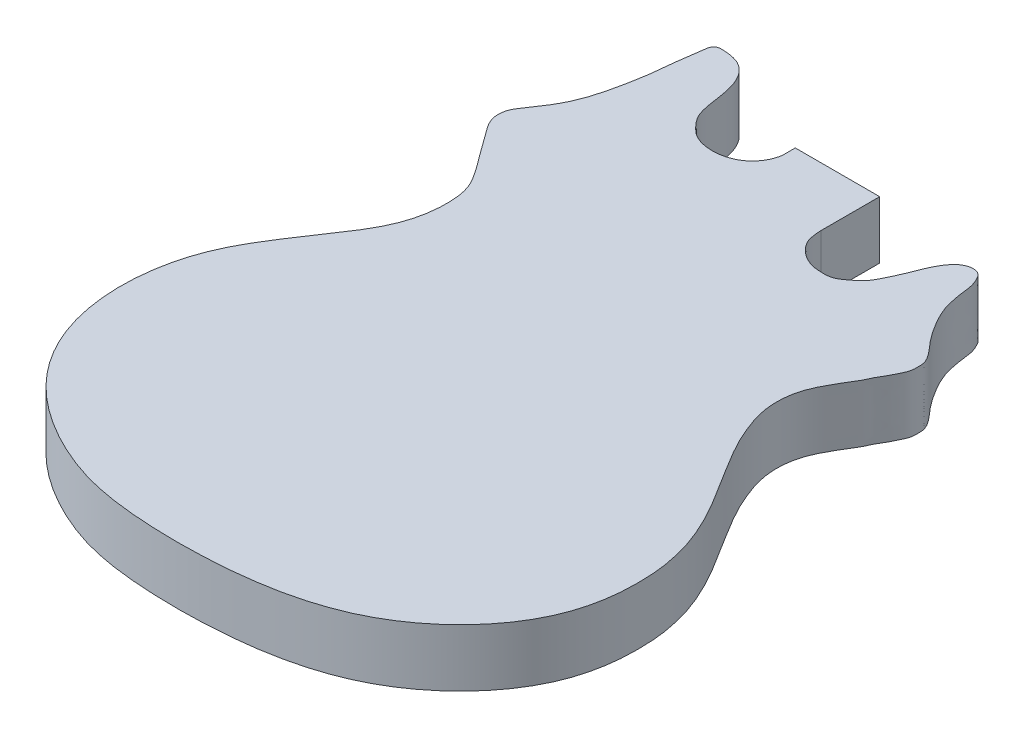
from build123d import *

# Parameters (mm, degrees)
BOSS_EXTRUDE1_DEPTH = 38.1


with BuildPart() as part:
    # Sketch1 → Boss-Extrude1 (new body)
    with BuildSketch(Plane(origin=(0, 0, 0), x_dir=(1, 0, 0), z_dir=(0, 1, 0))):
        with BuildLine():
            Line((366.883991573, 629.016482731), (366.883991573, 590.196800389))
            add(Edge.make_bspline(
                [(366.883991573, 590.196800389), (366.883991573, 588.721907352), (367.19538884, 585.916083136), (367.858429296, 580.868730205), (370.218301131, 576.638003721), (373.655967207, 572.913912014), (377.743592342, 569.646373817), (383.573889567, 566.898596584), (390.451252725, 566.258156737), (398.152644545, 566.261530517), (404.588586625, 571.033731223), (410.949677824, 576.083704953), (415.321825984, 584.401338354), (420.868571166, 596.52275749), (424.957746784, 609.035617041), (432.264639136, 616.878386573), (437.693112663, 619.09371419), (443.851152806, 618.35194404), (446.515597074, 613.311370609), (448.642354149, 608.203682212), (449.063572552, 602.574784341), (450.111658882, 596.350402716), (451.680776415, 587.862190501), (455.511908319, 579.431931165), (460.760977292, 570.728089525), (465.715796968, 563.472999064), (471.225219476, 557.625409545), (474.960319598, 552.644338219), (477.041501222, 548.646797619), (477.232146779, 544.285595262), (477.179636977, 538.900735945), (474.785544224, 534.530358586), (471.971226614, 528.396725227), (468.616650654, 523.796068396), (466.5381363, 518.275183369), (463.8413431, 514.164090623), (460.300299462, 508.100138554), (455.907780506, 500.531250533), (452.391236223, 492.092848175), (449.981513311, 481.130095668), (450.569869826, 467.189431042), (455.572045788, 453.111149682), (460.750769387, 441.535036147), (477.292195873, 412.245927358), (496.864695249, 386.695703012), (505.597355072, 354.323158527), (507.493636288, 344.994874506), (508.28446009, 331.977291802), (508.412874582, 314.027258269), (501.388195935, 276.24400292), (472.863087887, 240.162021779), (421.777866094, 207.408555055), (367.396037566, 198.275876582), (311.230783384, 198.274487469), (272.054128071, 202.886061008), (232.114648329, 218.257045268), (197.642917692, 242.05384781), (162.416064095, 296.629803101), (164.477696434, 358.459893243), (190.304262362, 402.825501368), (206.202004436, 426.428954899), (220.289060703, 446.992370446), (226.760910134, 467.505912703), (228.055204855, 482.280124743), (226.268259517, 497.506279524), (219.353810202, 509.093711617), (209.938935503, 521.261005131), (201.563054899, 533.324640229), (192.473656941, 545.130127737), (193.603643442, 555.883000736), (197.792322625, 561.23993479), (200.594636737, 565.606226537), (205.003411023, 572.122896272), (212.951584214, 586.194311068), (216.845453397, 602.806368162), (219.765885127, 617.781198681), (221.015835225, 627.055193529), (222.02031855, 639.51653599), (223.884773857, 650.13570789), (224.787051186, 658.216498006), (226.291917321, 660.74971688), (229.520608104, 661.369233987), (232.523523553, 661.132849097), (237.442515031, 660.672891522), (244.17177648, 658.881964171), (253.716491974, 649.500446484), (256.451919388, 635.102250961), (258.046801984, 622.776907993), (260.52163746, 614.545187826), (265.121474392, 608.811371735), (271.536250068, 602.484679717), (280.756867837, 599.677322856), (291.63099299, 599.842438536), (303.022419833, 604.493513433), (309.505892146, 613.469666376), (311.004029832, 619.764159781), (311.004029832, 621.790166204)],
                knots=[0, 0, 0, 0, 0.003159848, 0.005982303, 0.010803004, 0.013128653, 0.016777838, 0.021903279, 0.02654971, 0.031476224, 0.037806115, 0.042956872, 0.048709595, 0.057441956, 0.071591976, 0.076174965, 0.079681392, 0.083884061, 0.087866316, 0.090939812, 0.095781443, 0.099693652, 0.104433831, 0.114115253, 0.119168673, 0.126116006, 0.13277746, 0.136226348, 0.139412496, 0.142149227, 0.145425834, 0.150746318, 0.152450282, 0.159837564, 0.162719906, 0.164949512, 0.17028145, 0.177695976, 0.183572245, 0.189678104, 0.20149588, 0.212682646, 0.221324951, 0.228495674, 0.284386018, 0.287603833, 0.299887623, 0.304568309, 0.315372444, 0.338107475, 0.385165149, 0.407745679, 0.466775011, 0.498358573, 0.527971358, 0.549960145, 0.589189403, 0.614610655, 0.686418411, 0.703720531, 0.724061906, 0.747167858, 0.756237662, 0.769574979, 0.778551983, 0.788342064, 0.797786556, 0.811366727, 0.819933165, 0.828590353, 0.831653221, 0.834390535, 0.839639753, 0.848425383, 0.868652526, 0.875498574, 0.880975371, 0.888570806, 0.902140734, 0.903842094, 0.905977305, 0.907808844, 0.910448994, 0.912455767, 0.918334082, 0.924868891, 0.939757557, 0.948091562, 0.951602907, 0.957871749, 0.963487251, 0.97055908, 0.977641606, 0.986453336, 0.995699314, 1, 1, 1, 1], degree=3))
            Line((311.004029832, 621.790166204), (311.004029832, 629.016482731))
            Line((311.004029832, 629.016482731), (366.883991573, 629.016482731))
        make_face()
    extrude(amount=BOSS_EXTRUDE1_DEPTH)


solid = part.part
